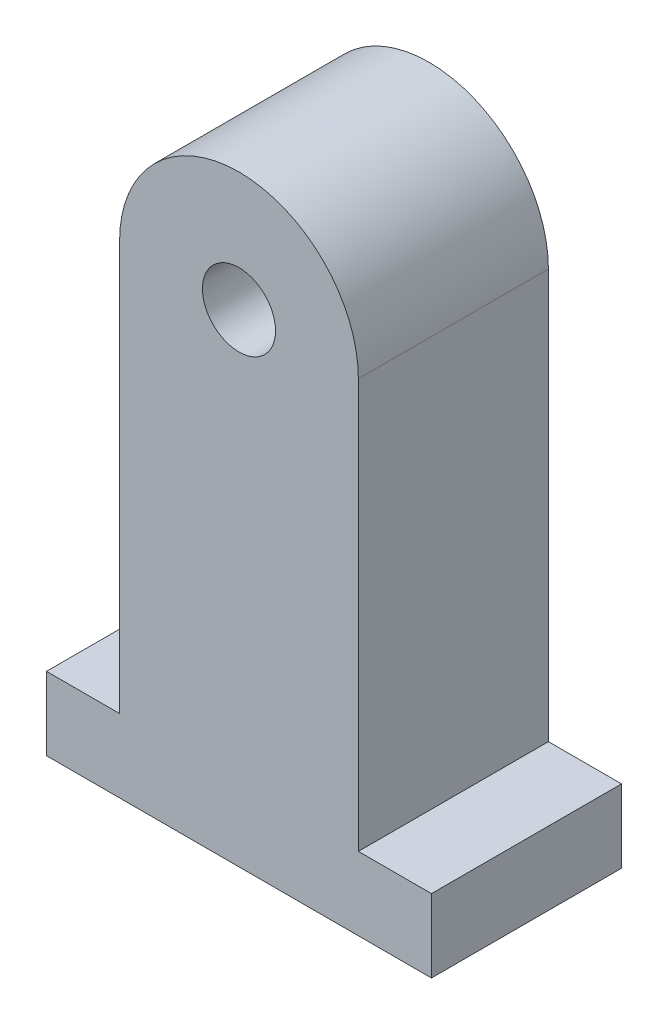
from build123d import *

# Parameters (mm, degrees)
SKETCH1_R           = 1.905
BOSS_EXTRUDE1_DEPTH = 4.953


with BuildPart() as part:
    # Sketch1 → Boss-Extrude1 (new, symmetric)
    with BuildSketch(Plane.XY):
        with BuildLine():
            Line((10.033, 0), (-10.033, 0))
            Line((-10.033, 0), (-10.033, 3.81))
            Line((-10.033, 3.81), (-6.223, 3.81))
            Line((-6.223, 3.81), (-6.223, 25.146))
            ThreePointArc((-6.223, 25.146), (0, 31.369), (6.223, 25.146))
            Line((6.223, 25.146), (6.223, 3.81))
            Line((6.223, 3.81), (10.033, 3.81))
            Line((10.033, 3.81), (10.033, 0))
        make_face()
        with Locations((0, 25.146)):
            Circle(SKETCH1_R, mode=Mode.SUBTRACT)
    extrude(amount=BOSS_EXTRUDE1_DEPTH, both=True)


solid = part.part
